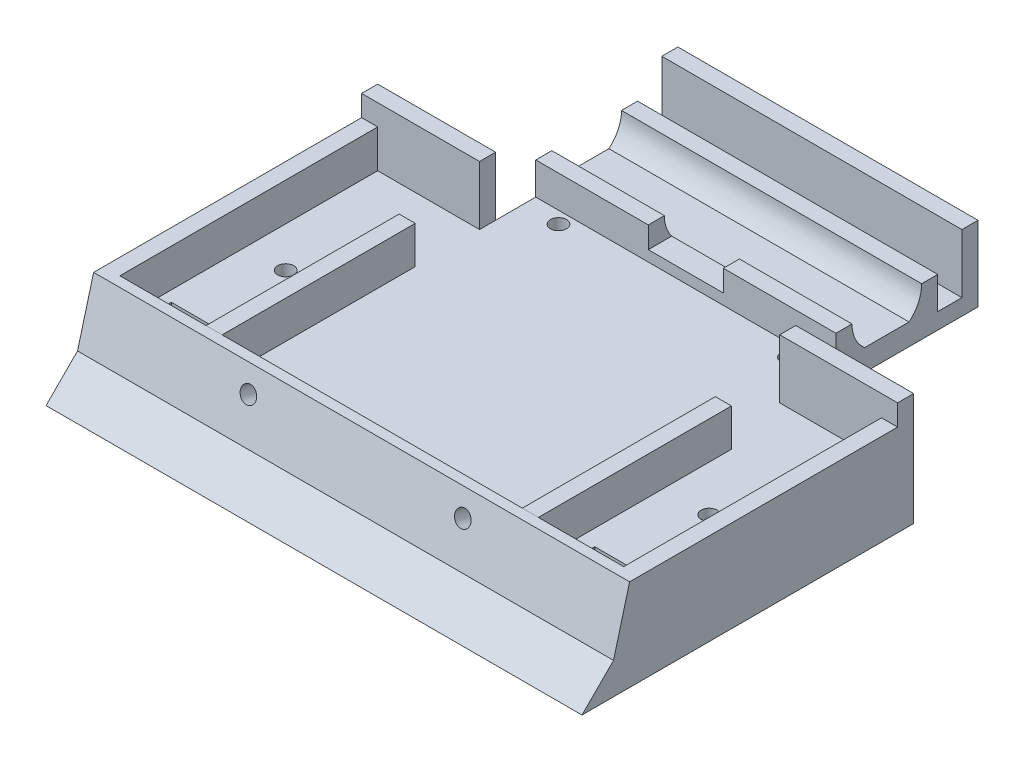
from build123d import *

# Parameters (mm, degrees)
ESBO_O1_W                 = 90
ESBO_O1_H                 = 10
RESSALTO_EXTRUS_O1_DEPTH  = 100
CORTE_EXTRUS_O1_DEPTH     = 73
ESBO_O5_W                 = 11
ESBO_O5_H                 = 6.5
CORTE_EXTRUS_O2_DEPTH     = 135.907375632
ESBO_O8_W                 = 94
ESBO_O8_H                 = 5
CORTE_EXTRUS_O3_DEPTH     = 3
ESBO_O9_W                 = 94
ESBO_O9_H                 = 84
RESSALTO_EXTRUS_O2_DEPTH  = 8
ESBO_O10_W                = 34
ESBO_O10_H                = 18
CORTE_EXTRUS_O4_DEPTH     = 22
ESBO_O11_W                = 34
ESBO_O11_H                = 18
CORTE_EXTRUS_O5_DEPTH     = 22
CORTE_EXTRUS_O8_DEPTH     = 100
ESBO_O19_W                = 53
ESBO_O19_H                = 0.919551387
CORTE_EXTRUS_O10_DEPTH    = 136.735036008
RESSALTO_EXTRUS_O4_DEPTH  = 56
ESBO_O21_W                = 3
ESBO_O21_H                = 3
RESSALTO_EXTRUS_O5_DEPTH  = 56
RESSALTO_EXTRUS_O6_DEPTH  = 100
ESBO_O25_R                = 1.5
CORTE_EXTRUS_O11_DEPTH    = 135.985184372
ESBO_O26_R                = 1.5
CORTE_EXTRUS_O14_DEPTH    = 135.985184372
ESBO_O28_W                = 3
ESBO_O28_H                = 51.10099753
RESSALTO_EXTRUS_O7_DEPTH  = 7
RESSALTO_EXTRUS_O8_DEPTH  = 62
ESBO_O30_W                = 16
ESBO_O30_H                = 3
RESSALTO_EXTRUS_O9_DEPTH  = 7
ESBO_O31_W                = 62
ESBO_O31_H                = 12
CORTE_EXTRUS_O15_DEPTH    = 7
ESBO_O33_W                = 3
ESBO_O33_H                = 3.919551387
RESSALTO_EXTRUS_O11_DEPTH = 22
ESBO_O34_W                = 3
ESBO_O34_H                = 3.919551387
RESSALTO_EXTRUS_O12_DEPTH = 22
ESBO_O35_W                = 19
ESBO_O35_H                = 0.080448613
RESSALTO_EXTRUS_O13_DEPTH = 3
ESBO_O36_R                = 1.5
CORTE_EXTRUS_O16_DEPTH    = 135.985184372
ESBO_O37_W                = 14
ESBO_O37_H                = 4
CORTE_EXTRUS_O17_DEPTH    = 6
RESSALTO_EXTRUS_O14_DEPTH = 100
ESBO_O39_R                = 1.5
ESBO_O39_R_2              = 1.500009338
CORTE_EXTRUS_O18_DEPTH    = 4
ESBO_O40_R                = 1.5
CORTE_EXTRUS_O19_DEPTH    = 10
CORTE_EXTRUS_O21_DEPTH    = 7
ESBO_O43_W                = 55
ESBO_O43_H                = 14.196322654
CORTE_EXTRUS_O23_DEPTH    = 2


with BuildPart() as part:
    # Esboço1 → Ressalto-extrusão1 (new body)
    with BuildSketch(Plane(origin=(0, 0, 0), x_dir=(0, 0, -1), z_dir=(1, 0, 0))):
        with Locations((45, 5)):
            Rectangle(ESBO_O1_W, ESBO_O1_H)
    extrude(amount=RESSALTO_EXTRUS_O1_DEPTH)

    # Esboço3 → Corte-extrusão1 (cut)
    with BuildSketch(Plane(origin=(0, 0, -90), x_dir=(-1, 0, 0), z_dir=(0, 0, -1))):
        Polygon((-93, 0), (-93, 2), (-97, 2), (-97, 7), (-3, 7), (-3, 2), (-7, 2), (-7, 0), align=None)
    extrude(amount=-CORTE_EXTRUS_O1_DEPTH, mode=Mode.SUBTRACT)

    # Esboço5 → Corte-extrusão2 (cut, through all)
    with BuildSketch(Plane(origin=(0, 10, 0), x_dir=(1, 0, 0), z_dir=(0, 1, 0))):
        with Locations((10.5, 9.25)):
            Rectangle(ESBO_O5_W, ESBO_O5_H)
        with Locations((89.5, 9.25)):
            Rectangle(ESBO_O5_W, ESBO_O5_H)
    extrude(amount=-CORTE_EXTRUS_O2_DEPTH, mode=Mode.SUBTRACT)

    # Esboço8 → Corte-extrusão3 (cut)
    with BuildSketch(Plane(origin=(0, 0, -17), x_dir=(-1, 0, 0), z_dir=(0, 0, -1))):
        with Locations((-50, 4.5)):
            Rectangle(ESBO_O8_W, ESBO_O8_H)
    extrude(amount=-CORTE_EXTRUS_O3_DEPTH, mode=Mode.SUBTRACT)

    # Esboço9 → Ressalto-extrusão2 (add)
    with BuildSketch(Plane(origin=(0, 10, 0), x_dir=(1, 0, 0), z_dir=(0, 1, 0))):
        Polygon((0, 1.678302474), (0, 0), (2, 0), (100, 0), (100, 1.678302474), (100, 90), (97, 90), (3, 90), (0, 90), align=None)
        with Locations((50, 45)):
            Rectangle(ESBO_O9_W, ESBO_O9_H, mode=Mode.SUBTRACT)
    extrude(amount=RESSALTO_EXTRUS_O2_DEPTH)

    # Esboço10 → Corte-extrusão4 (cut)
    with BuildSketch(Plane.ZY):
        with Locations((-73, 9)):
            Rectangle(ESBO_O10_W, ESBO_O10_H)
    extrude(amount=-CORTE_EXTRUS_O4_DEPTH, mode=Mode.SUBTRACT)

    # Esboço11 → Corte-extrusão5 (cut)
    with BuildSketch(Plane(origin=(100, 0, 0), x_dir=(0, 0, -1), z_dir=(1, 0, 0))):
        with Locations((73, 9)):
            Rectangle(ESBO_O11_W, ESBO_O11_H)
    extrude(amount=-CORTE_EXTRUS_O5_DEPTH, mode=Mode.SUBTRACT)

    # Esboço15 → Corte-extrusão8 (cut)
    with BuildSketch(Plane(origin=(100, 0, 0), x_dir=(0, 0, -1), z_dir=(1, 0, 0))):
        Polygon((0, 5.88429619), (3.246393052, 18), (0, 18), align=None)
    extrude(amount=-CORTE_EXTRUS_O8_DEPTH, mode=Mode.SUBTRACT)

    # Esboço19 → Corte-extrusão10 (cut, through all)
    with BuildSketch(Plane(origin=(100, 0, 0), x_dir=(0, 0, -1), z_dir=(1, 0, 0))):
        with Locations((29.5, 17.540224307)):
            Rectangle(ESBO_O19_W, ESBO_O19_H)
    extrude(amount=-CORTE_EXTRUS_O10_DEPTH, mode=Mode.SUBTRACT)

    # Esboço20 → Ressalto-extrusão4 (add)
    with BuildSketch(Plane(origin=(78, 0, 0), x_dir=(0, 0, -1), z_dir=(1, 0, 0))):
        with BuildLine():
            Line((68.839605241, 11), (77.137237802, 11))
            ThreePointArc((77.137237802, 11), (78.871318989, 13.239422392), (79.48840166, 16.003705155))
            Line((79.48840166, 16.003705155), (82.48840166, 16.003705155))
            Line((82.48840166, 16.003705155), (82.48840166, 14))
            Line((82.48840166, 14), (82.48840166, 13))
            Line((82.48840166, 13), (82.48840166, 10))
            Line((82.48840166, 10), (81.830476132, 10))
            Line((81.830476132, 10), (63.488441382, 10))
            Line((63.488441382, 10), (63.488441382, 14))
            Line((63.488441382, 14), (63.488441382, 16.003705155))
            Line((63.488441382, 16.003705155), (66.488441382, 16.003705155))
            ThreePointArc((66.488441382, 16.003705155), (67.105524053, 13.239422392), (68.839605241, 11))
        make_face()
    extrude(amount=-RESSALTO_EXTRUS_O4_DEPTH)

    # Esboço21 → Ressalto-extrusão5 (add)
    with BuildSketch(Plane(origin=(78, 0, 0), x_dir=(0, 0, -1), z_dir=(1, 0, 0))):
        with Locations((88.5, 19.5)):
            Rectangle(ESBO_O21_W, ESBO_O21_H)
    extrude(amount=-RESSALTO_EXTRUS_O5_DEPTH)

    # Esboço22 → Ressalto-extrusão6 (add)
    with BuildSketch(Plane(origin=(100, 0, 0), x_dir=(0, 0, -1), z_dir=(1, 0, 0))):
        Polygon((4.89900247, 17.080448613), (3, 10), (3, 17.080448613), align=None)
    extrude(amount=-RESSALTO_EXTRUS_O6_DEPTH)

    # Esboço25 → Corte-extrusão11 (cut, through all)
    with BuildSketch(Plane(origin=(0, 10, 0), x_dir=(1, 0, 0), z_dir=(0, 1, 0))):
        with Locations(Location((10.5, 28.335399636, 0), (0, 0, 270))):
            Circle(ESBO_O25_R)
    extrude(amount=-CORTE_EXTRUS_O11_DEPTH, mode=Mode.SUBTRACT)

    # Esboço26 → Corte-extrusão14 (cut, through all)
    with BuildSketch(Plane(origin=(0, 10, 0), x_dir=(1, 0, 0), z_dir=(0, 1, 0))):
        with Locations(Location((89.5, 28.335399636, 0), (0, 0, 270))):
            Circle(ESBO_O26_R)
    extrude(amount=-CORTE_EXTRUS_O14_DEPTH, mode=Mode.SUBTRACT)

    # Esboço28 → Ressalto-extrusão7 (add)
    with BuildSketch(Plane(origin=(0, 10, 0), x_dir=(1, 0, 0), z_dir=(0, 1, 0))):
        with Locations((20.5, 30.449501235)):
            Rectangle(ESBO_O28_W, ESBO_O28_H)
        with Locations((79.5, 30.449501235)):
            Rectangle(ESBO_O28_W, ESBO_O28_H)
    extrude(amount=RESSALTO_EXTRUS_O7_DEPTH)

    # Esboço29 → Ressalto-extrusão8 (add)
    with BuildSketch(Plane(origin=(81, 0, 0), x_dir=(0, 0, -1), z_dir=(1, 0, 0))):
        Polygon((4.89900247, 10), (3, 10), (4.89900247, 17.080448613), align=None)
    extrude(amount=-RESSALTO_EXTRUS_O8_DEPTH)

    # Esboço30 → Ressalto-extrusão9 (add)
    with BuildSketch(Plane(origin=(0, 17, 0), x_dir=(1, 0, 0), z_dir=(0, 1, 0))):
        with Locations((11, 54.5)):
            Rectangle(ESBO_O30_W, ESBO_O30_H)
        with Locations((89, 54.5)):
            Rectangle(ESBO_O30_W, ESBO_O30_H)
    extrude(amount=-RESSALTO_EXTRUS_O9_DEPTH)

    # Esboço31 → Corte-extrusão15 (cut)
    with BuildSketch(Plane(origin=(0, 17, 0), x_dir=(1, 0, 0), z_dir=(0, 1, 0))):
        with Locations((50, 47)):
            Rectangle(ESBO_O31_W, ESBO_O31_H)
    extrude(amount=-CORTE_EXTRUS_O15_DEPTH, mode=Mode.SUBTRACT)

    # Esboço33 → Ressalto-extrusão11 (add)
    with BuildSketch(Plane(origin=(100, 0, 0), x_dir=(0, 0, -1), z_dir=(1, 0, 0))):
        with Locations((54.5, 19.040224307)):
            Rectangle(ESBO_O33_W, ESBO_O33_H)
    extrude(amount=-RESSALTO_EXTRUS_O11_DEPTH)

    # Esboço34 → Ressalto-extrusão12 (add)
    with BuildSketch(Plane.ZY):
        with Locations((-54.5, 19.040224307)):
            Rectangle(ESBO_O34_W, ESBO_O34_H)
    extrude(amount=-RESSALTO_EXTRUS_O12_DEPTH)

    # Esboço35 → Ressalto-extrusão13 (add)
    with BuildSketch(Plane(origin=(0, 0, -56), x_dir=(-1, 0, 0), z_dir=(0, 0, -1))):
        with Locations((-12.5, 17.040224307)):
            Rectangle(ESBO_O35_W, ESBO_O35_H)
        with Locations((-87.5, 17.040224307)):
            Rectangle(ESBO_O35_W, ESBO_O35_H)
    extrude(amount=-RESSALTO_EXTRUS_O13_DEPTH)

    # Esboço36 → Corte-extrusão16 (cut, through all)
    with BuildSketch(Plane(origin=(0, 10, 0), x_dir=(1, 0, 0), z_dir=(0, 1, 0))):
        with Locations(Location((71.5, 61.233441382, 0), (0, 0, 270))):
            Circle(ESBO_O36_R)
        with Locations(Location((28.5, 61.233441382, 0), (0, 0, 270))):
            Circle(ESBO_O36_R)
        with Locations(Location((71.5, 84.74340166, 0), (0, 0, 270))):
            Circle(ESBO_O36_R)
        with Locations(Location((28.5, 84.74340166, 0), (0, 0, 270))):
            Circle(ESBO_O36_R)
    extrude(amount=-CORTE_EXTRUS_O16_DEPTH, mode=Mode.SUBTRACT)

    # Esboço37 → Corte-extrusão17 (cut)
    with BuildSketch(Plane.XY.offset(-63.488441382)):
        with Locations((50, 14.003705155)):
            Rectangle(ESBO_O37_W, ESBO_O37_H)
    extrude(amount=-CORTE_EXTRUS_O17_DEPTH, mode=Mode.SUBTRACT)

    # Esboço38 → Ressalto-extrusão14 (add, through all)
    with BuildSketch(Plane(origin=(100, 0, 0), x_dir=(0, 0, -1), z_dir=(1, 0, 0))):
        Polygon((0, 0), (-5.88429619, 0), (0, 5.88429619), align=None)
    extrude(amount=-RESSALTO_EXTRUS_O14_DEPTH)

    # Esboço39 → Corte-extrusão18 (cut)
    with BuildSketch(Plane(origin=(0, 0.394173103, 1.471074047), x_dir=(1, 0, 0), z_dir=(0, 0.258819045102519, 0.9659258262890689))):
        with Locations(Location((30, 12.950688916, 0), (0, 0, 270))):
            Circle(ESBO_O39_R)
        with Locations(Location((70, 12.950688916, 0), (0, 0, 270))):
            Circle(ESBO_O39_R_2)
    extrude(amount=-CORTE_EXTRUS_O18_DEPTH, mode=Mode.SUBTRACT)

    # Esboço40 → Corte-extrusão19 (cut)
    with BuildSketch(Plane.XZ):
        with Locations(Location((28.5, -10.233441382, 0), (0, 0, 270))):
            Circle(ESBO_O40_R)
        with Locations(Location((71.5, -10.233441382, 0), (0, 0, 270))):
            Circle(ESBO_O40_R)
    extrude(amount=-CORTE_EXTRUS_O19_DEPTH, mode=Mode.SUBTRACT)

    # Esboço42 → Corte-extrusão21 (cut)
    with BuildSketch(Plane(origin=(0, 0, -14), x_dir=(-1, 0, 0), z_dir=(0, 0, -1))):
        Polygon((-77.5, 7), (-22.5, 7), (-22.5, 2), (-22.5, 0), (-77.5, 0), (-77.5, 2), align=None)
    extrude(amount=-CORTE_EXTRUS_O21_DEPTH, mode=Mode.SUBTRACT)

    # Esboço43 → Corte-extrusão23 (cut)
    with BuildSketch(Plane.XZ):
        with Locations((50, -14.098161327)):
            Rectangle(ESBO_O43_W, ESBO_O43_H)
    extrude(amount=-CORTE_EXTRUS_O23_DEPTH, mode=Mode.SUBTRACT)


solid = part.part
